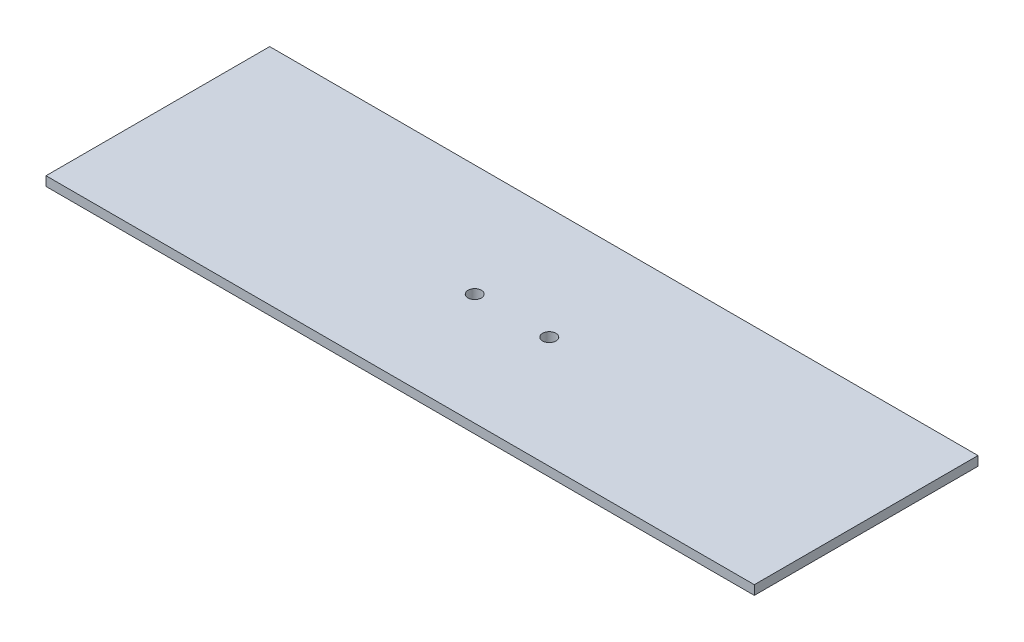
from build123d import *

# Parameters (mm, degrees)
SKETCH1_W           = 241.3
SKETCH1_H           = 76.2
SKETCH1_R           = 2.286
BOSS_EXTRUDE1_DEPTH = 3.175


with BuildPart() as part:
    # Sketch1 → Boss-Extrude1 (new body)
    with BuildSketch(Plane(origin=(0, 0, 0), x_dir=(1, 0, 0), z_dir=(0, 1, 0))):
        Rectangle(SKETCH1_W, SKETCH1_H)
        with Locations(Location((-12.7, 0, 0), (0, 0, 270))):
            Circle(SKETCH1_R, mode=Mode.SUBTRACT)
        with Locations(Location((12.7, 0, 0), (0, 0, 270))):
            Circle(SKETCH1_R, mode=Mode.SUBTRACT)
    extrude(amount=BOSS_EXTRUDE1_DEPTH)


solid = part.part
